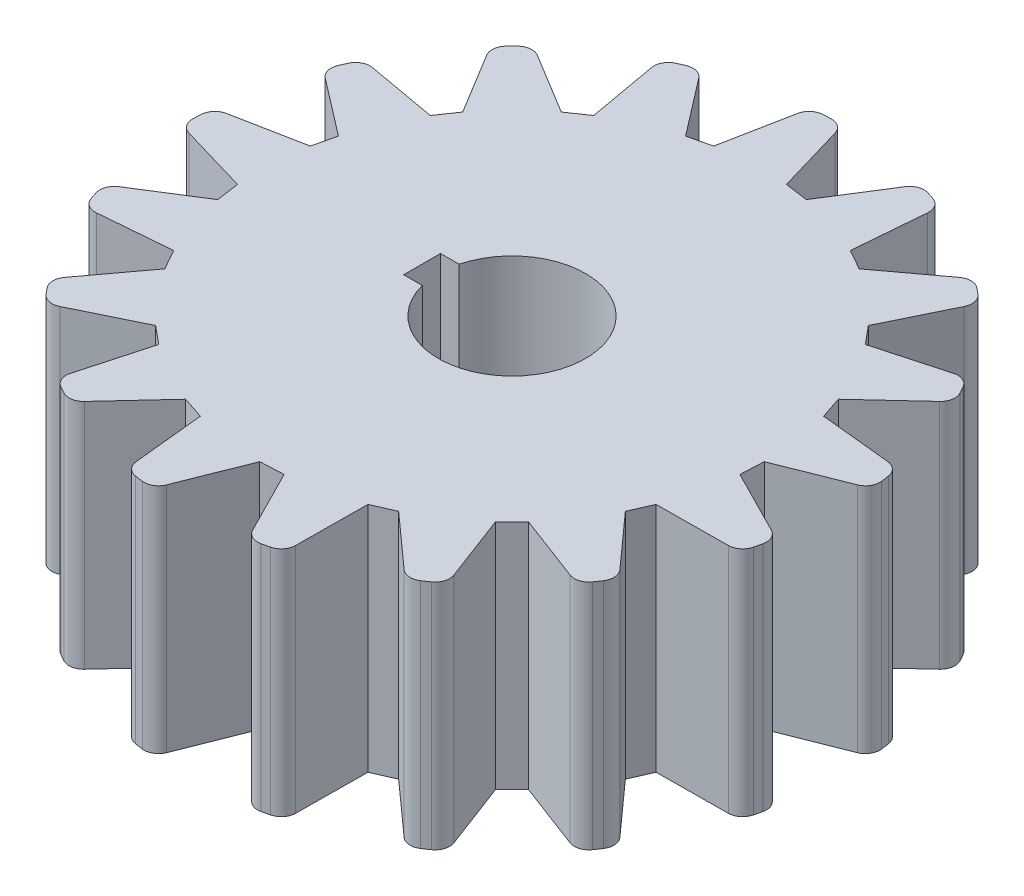
from build123d import *

# Parameters (mm, degrees)
ENL_V_MAT_EXTRU_3_DEPTH            = 90.988888203
CONG_1_R                           = 2.5
R_P_TITION_CIRCULAIRE1_COUNT       = 17
CONG_1_OF_R_P_TITION_CIRCULAIRE1_R = 2.5
ENL_V_MAT_EXTRU_4_DEPTH            = 90.948550801


with BuildPart() as part:
    # Esquisse1 → Révolution1 (revolve)
    with BuildSketch(Plane.XY, mode=Mode.PRIVATE) as r_volution1_sk:
        Polygon((-57, 40), (-57, 0), (-50, 0), (0, 0), (0, 40), (-50, 40), align=None)
    revolve(r_volution1_sk.sketch.rotate(Axis((0, 40, 0), (0, -1, 0)), 270), axis=Axis((0, 40, 0), (0, -1, 0)))

    # Esquisse5 → Enlèv. mat.-Extru.3 (cut, through all)
    with BuildSketch(Plane(origin=(0, 40, 0), x_dir=(1, 0, 0), z_dir=(0, 1, 0))):
        with BuildLine():
            ThreePointArc((-5.25929649, 56.756848049), (-13.050181347, 55.485969099), (-20.590774973, 53.150917076))
            Line((-20.590774973, 53.150917076), (-11.904340069, 41.839415478))
            Line((-11.904340069, 41.839415478), (-7.993104026, 42.759329836))
            Line((-7.993104026, 42.759329836), (-5.25929649, 56.756848049))
        make_face()
    enl_v_mat_extru_3 = extrude(amount=-ENL_V_MAT_EXTRU_3_DEPTH, mode=Mode.SUBTRACT)

    # Congé1
    cong_1_edges = [part.edges().sort_by_distance(p)[0] for p in [
        (-20.590774973, 20, -53.150917076),
        (-5.25929649, 20, -56.756848049),
    ]]
    fillet(cong_1_edges, radius=CONG_1_R)

    # Répétition circulaire1: Enlèv. mat.-Extru.3 ×17 about axis
    r_p_tition_circulaire1_axis = Axis((0, 0, 0), (0, 1, 0))
    for i in range(1, R_P_TITION_CIRCULAIRE1_COUNT):
        add(enl_v_mat_extru_3.rotate(r_p_tition_circulaire1_axis, i * 360 / R_P_TITION_CIRCULAIRE1_COUNT), mode=Mode.SUBTRACT)

    # Congé1 of Répétition circulaire1
    cong_1_of_r_p_tition_circulaire1_edges = [part.edges().sort_by_distance(p)[0] for p in [
        (-38.400651688, 20, -42.123508282),
        (-25.40708628, 20, -51.024307607),
        (-51.024307607, 20, -25.407086279),
        (-42.123508282, 20, -38.400651688),
        (-56.756848049, 20, -5.259296489),
        (-53.150917076, 20, -20.590774972),
        (-54.824061661, 20, 15.598790434),
        (-57, 20, 0),
        (-45.486981955, 20, 34.350174274),
        (-53.150917076, 20, 20.590774973),
        (-30.006633284, 20, 48.462376737),
        (-42.123508281, 20, 38.400651688),
        (-10.473722516, 20, 56.029466682),
        (-25.407086279, 20, 51.024307607),
        (10.473722516, 20, 56.029466682),
        (-5.259296489, 20, 56.756848049),
        (30.006633284, 20, 48.462376737),
        (15.598790435, 20, 54.824061661),
        (45.486981955, 20, 34.350174274),
        (34.350174274, 20, 45.486981955),
        (54.824061661, 20, 15.598790434),
        (48.462376737, 20, 30.006633284),
        (56.756848049, 20, -5.259296489),
        (56.029466682, 20, 10.473722515),
        (51.024307607, 20, -25.407086279),
        (56.029466682, 20, -10.473722516),
        (38.400651688, 20, -42.123508282),
        (48.462376736, 20, -30.006633284),
        (20.590774973, 20, -53.150917076),
        (34.350174273, 20, -45.486981955),
        (0, 20, -57),
        (15.598790434, 20, -54.824061661),
    ]]
    fillet(cong_1_of_r_p_tition_circulaire1_edges, radius=CONG_1_OF_R_P_TITION_CIRCULAIRE1_R)

    # Esquisse6 → Enlèv. mat.-Extru.4 (cut, through all)
    with BuildSketch(Plane(origin=(0, 40, 0), x_dir=(1, 0, 0), z_dir=(0, 1, 0))):
        with BuildLine():
            Line((-12.296722124, 3.175), (-15.496722124, 3.175))
            Line((-15.496722124, 3.175), (-15.496722124, -3.175))
            Line((-15.496722124, -3.175), (-12.296722124, -3.175))
            ThreePointArc((-12.296722124, -3.175), (12.7, 0), (-12.296722124, 3.175))
        make_face()
    extrude(amount=-ENL_V_MAT_EXTRU_4_DEPTH, mode=Mode.SUBTRACT)


solid = part.part
